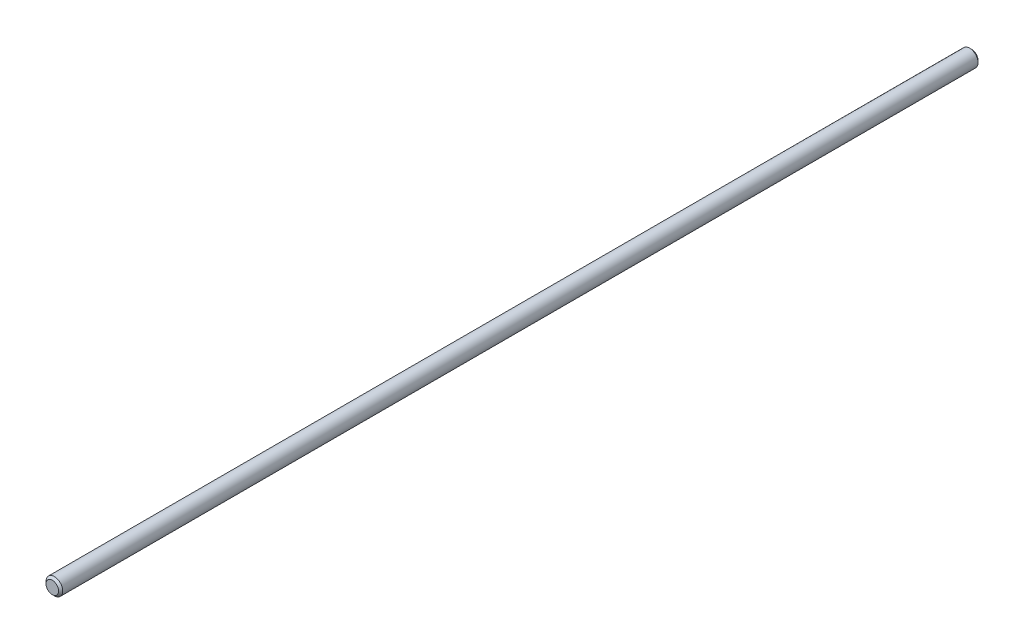
from build123d import *

# Parameters (mm, degrees)
SKETCH1_R           = 2
BOSS_EXTRUDE1_DEPTH = 110
CHAMFER1_SIZE       = 0.5


with BuildPart() as part:
    # Sketch1 → Boss-Extrude1 (new, symmetric)
    with BuildSketch(Plane.XY):
        Circle(SKETCH1_R)
    extrude(amount=BOSS_EXTRUDE1_DEPTH, both=True)

    # Chamfer1
    chamfer1_edges = [part.edges().sort_by_distance(p)[0] for p in [
        (-2, 0, -110),
        (-2, 0, 110),
    ]]
    chamfer(chamfer1_edges, length=CHAMFER1_SIZE)


solid = part.part
